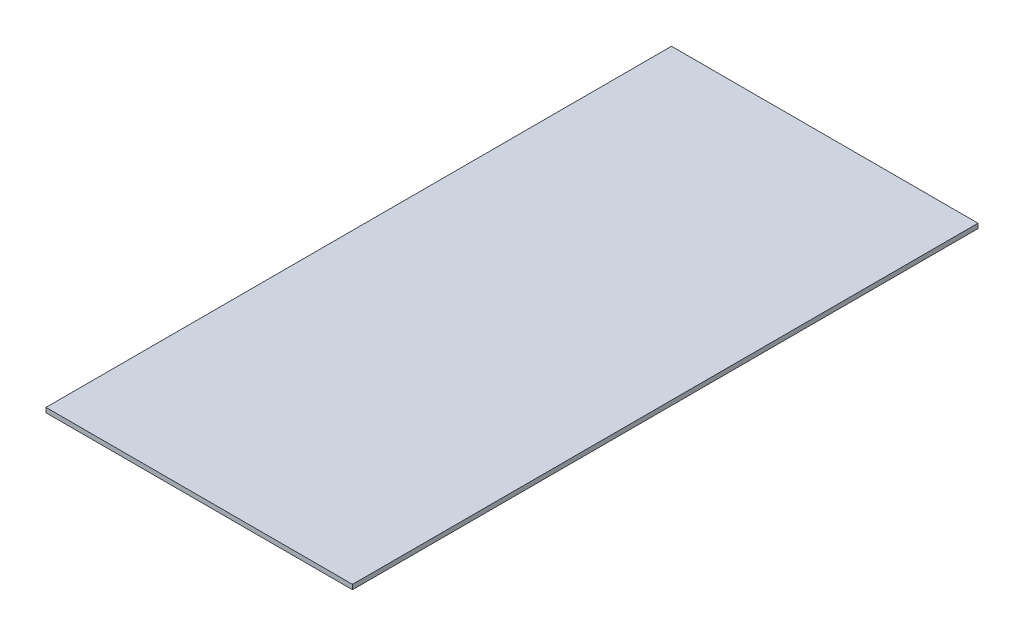
from build123d import *

# Parameters (mm, degrees)
SKETCH1_W           = 196
SKETCH1_H           = 400
BOSS_EXTRUDE1_DEPTH = 3


with BuildPart() as part:
    # Sketch1 → Boss-Extrude1 (new body)
    with BuildSketch(Plane(origin=(0, 0, 0), x_dir=(1, 0, 0), z_dir=(0, 1, 0))):
        with Locations((98, 200)):
            Rectangle(SKETCH1_W, SKETCH1_H)
    extrude(amount=BOSS_EXTRUDE1_DEPTH)


solid = part.part
